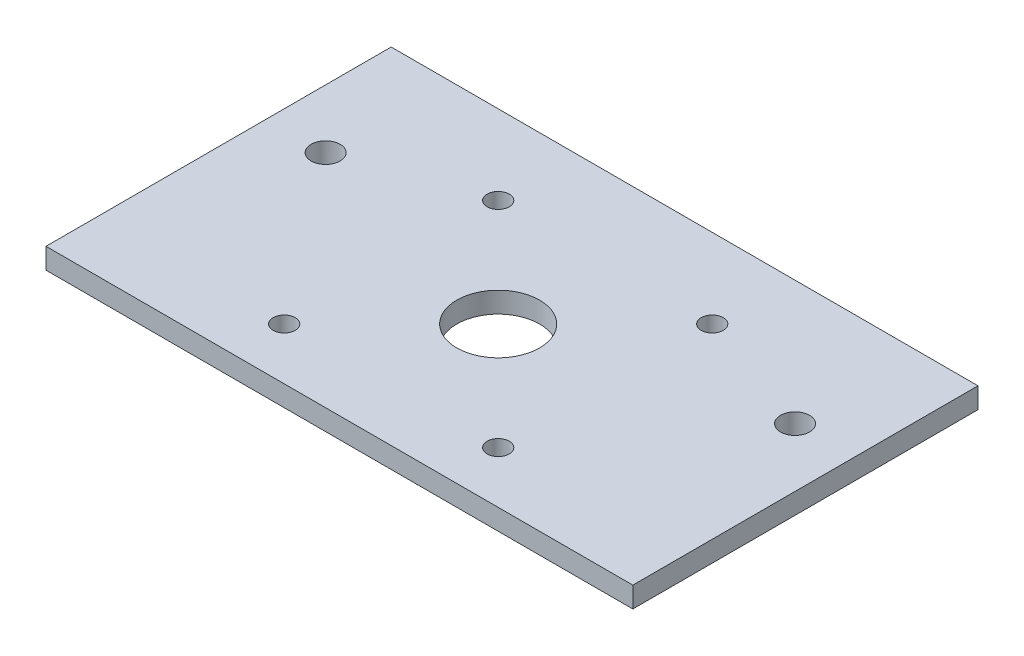
from build123d import *

# Parameters (mm, degrees)
SKETCH1_W           = 130
SKETCH1_H           = 90
BOSS_EXTRUDE1_DEPTH = 3
SKETCH2_R           = 1.6
CUT_EXTRUDE1_DEPTH  = 10
SKETCH3_R           = 2.1
CUT_EXTRUDE2_DEPTH  = 10
SKETCH4_R           = 6
CUT_EXTRUDE3_DEPTH  = 10
SKETCH5_W           = 211.899285322
SKETCH5_H           = 138.032985156
SKETCH5_W_2         = 85
SKETCH5_H_2         = 50
CUT_EXTRUDE4_DEPTH  = 10


with BuildPart() as part:
    # Sketch1 → Boss-Extrude1 (new body)
    with BuildSketch(Plane(origin=(0, 0, 0), x_dir=(1, 0, 0), z_dir=(0, 1, 0))):
        Rectangle(SKETCH1_W, SKETCH1_H)
    extrude(amount=BOSS_EXTRUDE1_DEPTH)

    # Sketch2 → Cut-Extrude1 (cut)
    with BuildSketch(Plane(origin=(0, 3, 0), x_dir=(1, 0, 0), z_dir=(0, 1, 0))):
        with Locations(Location((15.5, 2.5, 0), (0, 0, 270))):
            Circle(SKETCH2_R)
        with Locations(Location((-15.5, 2.5, 0), (0, 0, 270))):
            Circle(SKETCH2_R)
        with Locations(Location((-15.5, 33.5, 0), (0, 0, 270))):
            Circle(SKETCH2_R)
        with Locations(Location((15.5, 33.5, 0), (0, 0, 270))):
            Circle(SKETCH2_R)
    extrude(amount=-CUT_EXTRUDE1_DEPTH, mode=Mode.SUBTRACT)

    # Sketch3 → Cut-Extrude2 (cut)
    with BuildSketch(Plane.XZ):
        with Locations(Location((-34, -27, 0), (0, 0, 270))):
            Circle(SKETCH3_R)
        with Locations(Location((34, -27, 0), (0, 0, 270))):
            Circle(SKETCH3_R)
    extrude(amount=-CUT_EXTRUDE2_DEPTH, mode=Mode.SUBTRACT)

    # Sketch4 → Cut-Extrude3 (cut)
    with BuildSketch(Plane.XZ):
        with Locations(Location((0, -18, 0), (0, 0, 270))):
            Circle(SKETCH4_R)
    extrude(amount=-CUT_EXTRUDE3_DEPTH, mode=Mode.SUBTRACT)

    # Sketch5 → Cut-Extrude4 (cut)
    with BuildSketch(Plane(origin=(0, 3, 0), x_dir=(1, 0, 0), z_dir=(0, 1, 0))):
        with Locations((0.497416163, -6.590764156)):
            Rectangle(SKETCH5_W, SKETCH5_H)
        with Locations((0, 20)):
            Rectangle(SKETCH5_W_2, SKETCH5_H_2, mode=Mode.SUBTRACT)
    extrude(amount=-CUT_EXTRUDE4_DEPTH, mode=Mode.SUBTRACT)


solid = part.part
